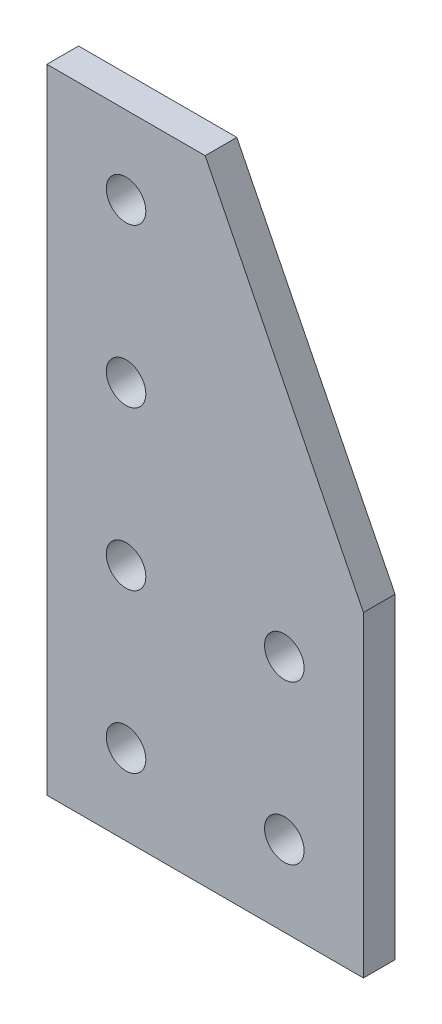
from build123d import *

# Parameters (mm, degrees)
SKETCH1_R           = 2.5
BOSS_EXTRUDE1_DEPTH = 4


with BuildPart() as part:
    # Sketch1 → Boss-Extrude1 (new body)
    with BuildSketch(Plane.XY):
        Polygon((0, -40), (0, 40), (20, 40), (40, 0), (40, -40), align=None)
        with Locations((10, -29.84)):
            Circle(SKETCH1_R, mode=Mode.SUBTRACT)
        with Locations((30, -29.84)):
            Circle(SKETCH1_R, mode=Mode.SUBTRACT)
        with Locations((10, -9.84)):
            Circle(SKETCH1_R, mode=Mode.SUBTRACT)
        with Locations((10, 10.16)):
            Circle(SKETCH1_R, mode=Mode.SUBTRACT)
        with Locations((10, 30.16)):
            Circle(SKETCH1_R, mode=Mode.SUBTRACT)
        with Locations((30, -9.84)):
            Circle(SKETCH1_R, mode=Mode.SUBTRACT)
    extrude(amount=BOSS_EXTRUDE1_DEPTH)


solid = part.part
